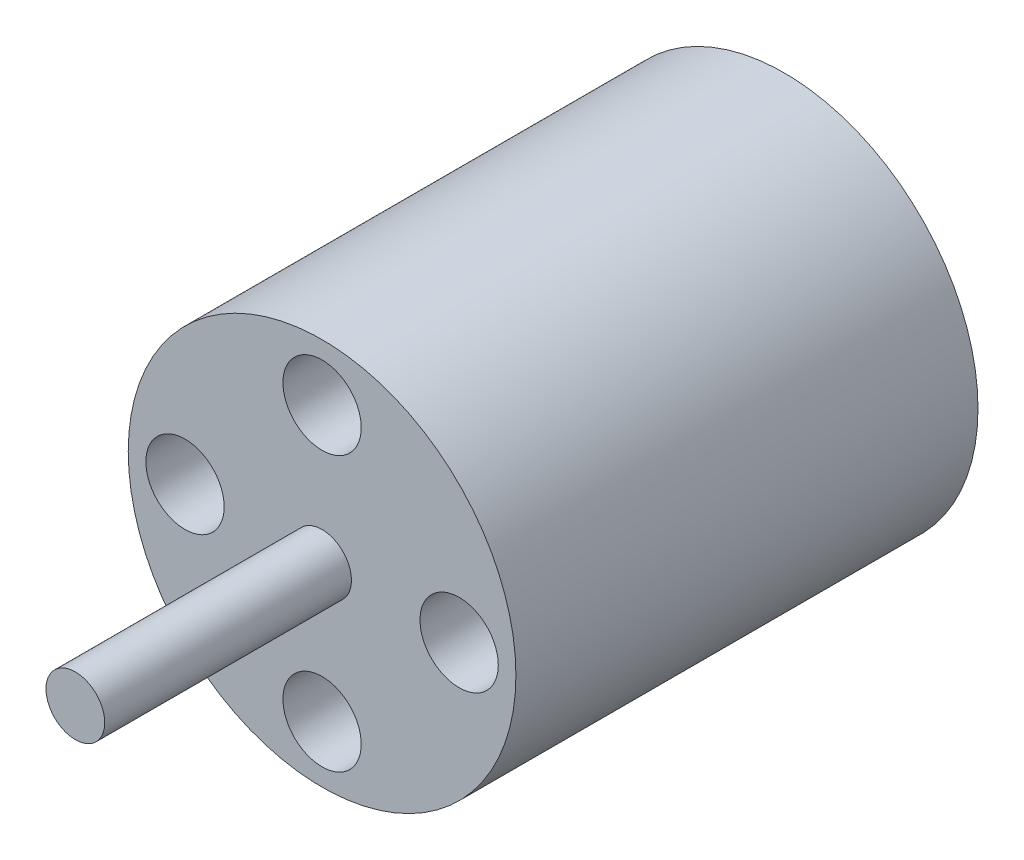
from build123d import *

# Parameters (mm, degrees)
SKETCH1_R           = 4.95
SKETCH1_R_2         = 1
SKETCH1_R_3         = 0.75
BOSS_EXTRUDE1_DEPTH = 11.8
SKETCH1_3_R         = 0.75
BOSS_EXTRUDE2_DEPTH = 18.1
CUT_EXTRUDE1_START  = 11.8
SKETCH1_5_R         = 1
CUT_EXTRUDE1_DEPTH  = 2


with BuildPart() as part:
    # Sketch1 → Boss-Extrude1 (new body)
    # profile 1 of 5: a face of its own
    with BuildSketch(Plane.XY):
        Circle(SKETCH1_R)
        with Locations((-3.5, 0)):
            Circle(SKETCH1_R_2, mode=Mode.SUBTRACT)
        with Locations((0, -3.5)):
            Circle(SKETCH1_R_2, mode=Mode.SUBTRACT)
        with Locations((3.5, 0)):
            Circle(SKETCH1_R_2, mode=Mode.SUBTRACT)
        with Locations((0, 3.5)):
            Circle(SKETCH1_R_2, mode=Mode.SUBTRACT)
        Circle(SKETCH1_R_3, mode=Mode.SUBTRACT)
    # profile 2 of 5: a face of its own
    with BuildSketch(Plane.XY):
        with Locations((-3.5, 0)):
            Circle(SKETCH1_R_2)
    # profile 3 of 5: a face of its own
    with BuildSketch(Plane.XY):
        with Locations((0, 3.5)):
            Circle(SKETCH1_R_2)
    # profile 4 of 5: a face of its own
    with BuildSketch(Plane.XY):
        with Locations((3.5, 0)):
            Circle(SKETCH1_R_2)
    # profile 5 of 5: a face of its own
    with BuildSketch(Plane.XY):
        with Locations((0, -3.5)):
            Circle(SKETCH1_R_2)
    extrude(amount=BOSS_EXTRUDE1_DEPTH)

    # Sketch1<3> → Boss-Extrude2 (add)
    with BuildSketch(Plane.XY):
        with Locations(Location((0, 0, 0), (0, 0, 180))):
            Circle(SKETCH1_3_R)
    extrude(amount=BOSS_EXTRUDE2_DEPTH)

    # Sketch1<5> → Cut-Extrude1 (cut)
    with BuildSketch(Plane.XY.offset(CUT_EXTRUDE1_START)):
        with Locations((0, 3.5)):
            Circle(SKETCH1_5_R)
        with Locations((-3.5, 0)):
            Circle(SKETCH1_5_R)
        with Locations((3.5, 0)):
            Circle(SKETCH1_5_R)
        with Locations((0, -3.5)):
            Circle(SKETCH1_5_R)
    extrude(amount=-CUT_EXTRUDE1_DEPTH, mode=Mode.SUBTRACT)


solid = part.part
